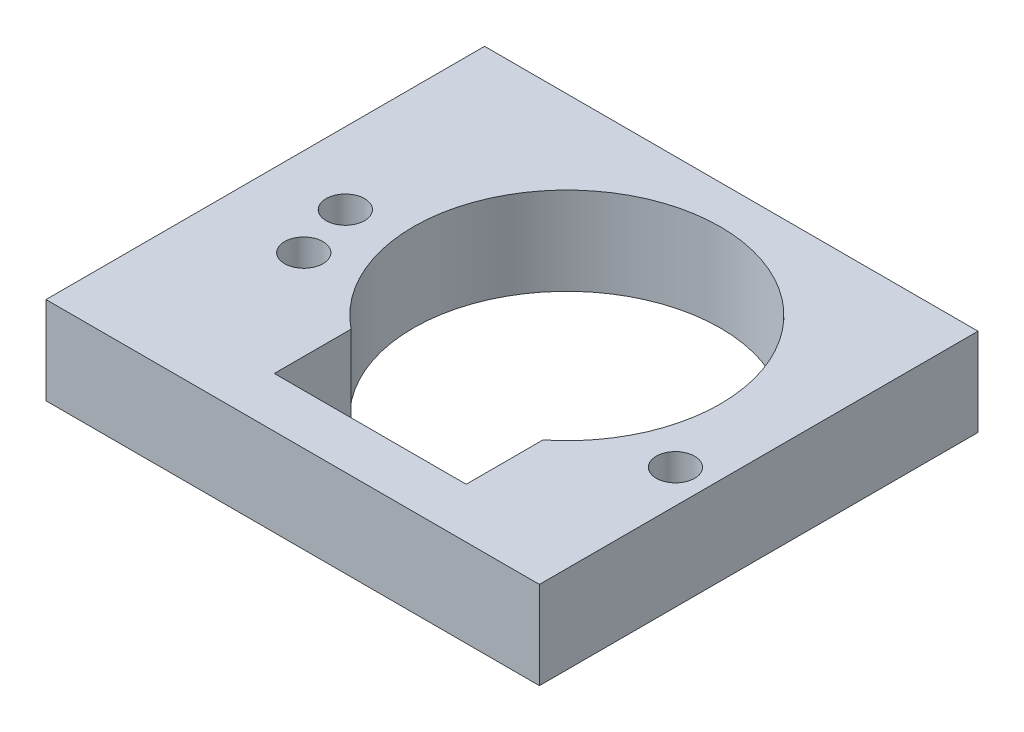
from build123d import *

# Parameters (mm, degrees)
SKETCH2_W                          = 45
SKETCH2_H                          = 40
STEPPER_SLIDER_BOSS_EXTRUDE1_DEPTH = 8
SKETCH1_R                          = 1.75
STEPPER_HOLE_CUT_EXTRUDE1_DEPTH    = 8


with BuildPart() as part:
    # Sketch2 → Stepper Slider Boss-Extrude1 (new body)
    with BuildSketch(Plane(origin=(0, 0, 0), x_dir=(1, 0, 0), z_dir=(0, 1, 0))):
        with Locations((-2.5, -2.5)):
            Rectangle(SKETCH2_W, SKETCH2_H)
    extrude(amount=-STEPPER_SLIDER_BOSS_EXTRUDE1_DEPTH)

    # Sketch1 → Stepper Hole Cut-Extrude1 (cut)
    with BuildSketch(Plane(origin=(0, 0, 0), x_dir=(1, 0, 0), z_dir=(0, 1, 0))):
        with Locations(Location((-18.45, -1.75, 0), (0, 0, 270))):
            Circle(SKETCH1_R)
        with Locations(Location((16.95, -7.041502622, 0), (0, 0, 270))):
            Circle(SKETCH1_R)
        with Locations(Location((-16.95, -7.041502622, 0), (0, 0, 270))):
            Circle(SKETCH1_R)
        with BuildLine():
            Line((8.75, -17.928746497), (8.75, -10.928746497))
            ThreePointArc((8.75, -10.928746497), (0, 14), (-8.75, -10.928746497))
            Line((-8.75, -10.928746497), (-8.75, -17.928746497))
            Line((-8.75, -17.928746497), (8.75, -17.928746497))
        make_face()
    extrude(amount=-STEPPER_HOLE_CUT_EXTRUDE1_DEPTH, mode=Mode.SUBTRACT)


solid = part.part
